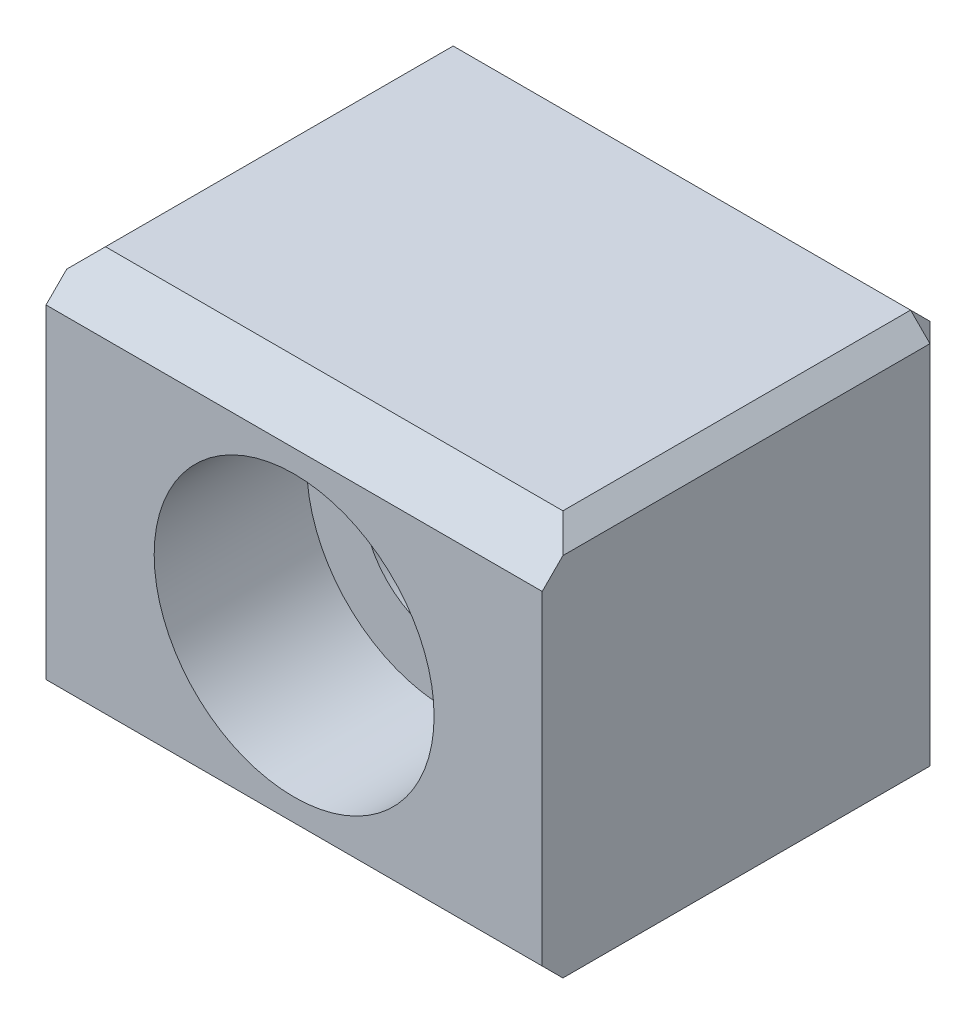
from build123d import *

# Parameters (mm, degrees)
SKETCH1_W                      = 19.5
SKETCH1_H                      = 16
EXTRUDE1_DEPTH                 = 7.95
CBORE_FOR_M6_SHCS1_D           = 6.6
CBORE_FOR_M6_SHCS1_CBORE_D     = 11
CBORE_FOR_M6_SHCS1_CBORE_DEPTH = 6
CHAMFER1_SIZE                  = 0.762
CHAMFER2_SIZE                  = 1.5748


with BuildPart() as part:
    # Sketch1 → Extrude1 (new, symmetric)
    with BuildSketch(Plane(origin=(0, 0, 0), x_dir=(1, 0, 0), z_dir=(0, 1, 0))):
        Rectangle(SKETCH1_W, SKETCH1_H)
    extrude(amount=EXTRUDE1_DEPTH, both=True)

    # CBORE for M6 SHCS1 (through all)
    with Locations(Plane.XY.offset(8)):
        with Locations((0, 0)):
            CounterBoreHole(CBORE_FOR_M6_SHCS1_D / 2, CBORE_FOR_M6_SHCS1_CBORE_D / 2, CBORE_FOR_M6_SHCS1_CBORE_DEPTH)

    # Chamfer1
    chamfer1_edges = [part.edges().sort_by_distance(p)[0] for p in [
        (9.75, 7.95, 0),
        (0, 7.95, -8),
        (-9.75, 7.95, 0),
        (0, -7.95, -8),
        (9.75, -7.95, 0),
        (-9.75, -7.95, 0),
        (-9.75, 0, -8),
        (9.75, 0, -8),
    ]]
    chamfer(chamfer1_edges, length=CHAMFER1_SIZE)

    # Chamfer2
    chamfer2_edges = [part.edges().sort_by_distance(p)[0] for p in [
        (0, -7.95, 8),
        (0, 7.95, 8),
    ]]
    chamfer(chamfer2_edges, length=CHAMFER2_SIZE)


solid = part.part
